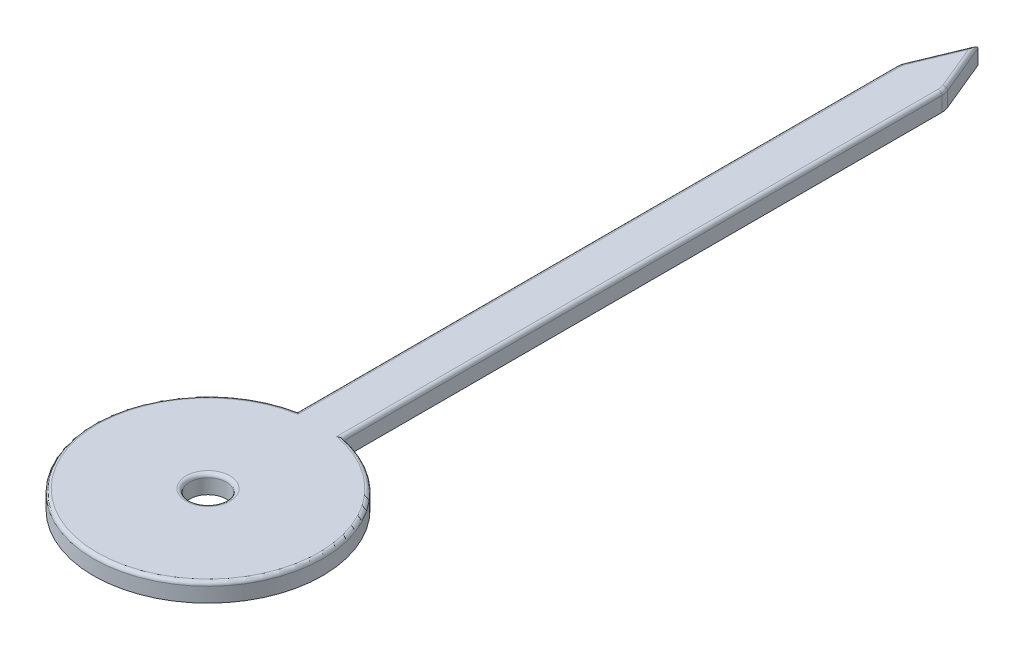
from build123d import *

# Parameters (mm, degrees)
SKETCH_1_R      = 0.1
EXTRUDE_1_DEPTH = 0.1
FILLET_1_R      = 0.1
FILLET_2_R      = 0.02


with BuildPart() as part:
    # 草图1 → 凸台-拉伸1 (new body)
    with BuildSketch(Plane(origin=(0, 0, 0), x_dir=(1, 0, 0), z_dir=(0, 1, 0))):
        with BuildLine():
            Line((-0.125, 3.898223305), (0, 4.2))
            Line((0, 4.2), (0.125, 3.898223305))
            Line((0.125, 3.898223305), (0.125, 0.612372436))
            ThreePointArc((0.125, 0.612372436), (0, -0.625), (-0.125, 0.612372436))
            Line((-0.125, 0.612372436), (-0.125, 3.898223305))
        make_face()
        with Locations(Location((0, 0, 0), (0, 0, 270))):
            Circle(SKETCH_1_R, mode=Mode.SUBTRACT)
    extrude(amount=EXTRUDE_1_DEPTH)

    # 圆角1
    fillet_1_edges = [part.edges().sort_by_distance(p)[0] for p in [
        (0.125, 0.05, -3.898223305),
        (-0.125, 0.05, -3.898223305),
    ]]
    fillet(fillet_1_edges, radius=FILLET_1_R)

    # 圆角2
    fillet_2_edges = [part.edges().sort_by_distance(p)[0] for p in [
        (-0.125, 0.1, -2.245352252),
        (-0.123078528, 0.1, -3.8978411),
        (0, 0.1, 0.625),
        (-0.058693977, 0.1, -4.058300206),
        (0.125, 0.1, -2.245352252),
        (0.058693977, 0.1, -4.058300206),
        (0.123078528, 0.1, -3.8978411),
        (0, 0.1, -0.1),
    ]]
    fillet(fillet_2_edges, radius=FILLET_2_R)


solid = part.part
